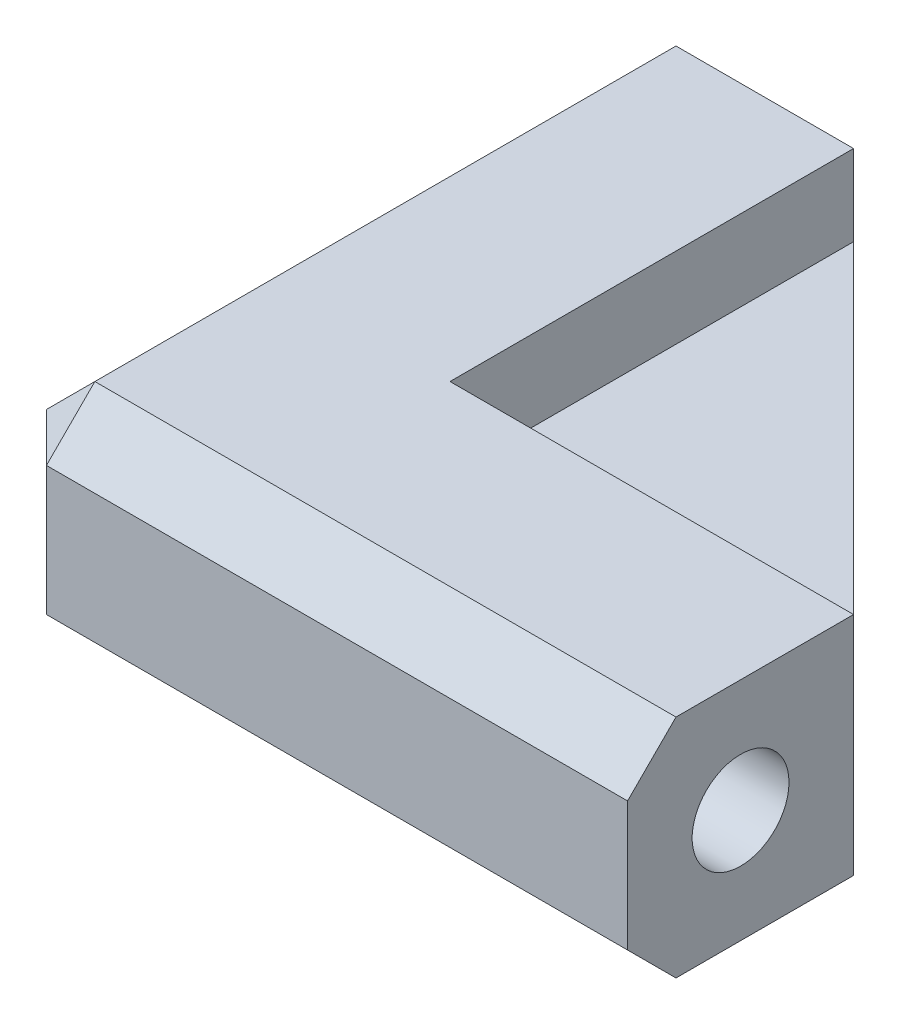
from build123d import *

# Parameters (mm, degrees)
BOSS_EXTRUDE1_DEPTH = 3.5
SKETCH2_R           = 1.5
CUT_EXTRUDE1_DEPTH  = 14
SKETCH3_R           = 1.5
CUT_EXTRUDE2_DEPTH  = 14
BOSS_EXTRUDE2_DEPTH = 1
CHAMFER1_SIZE       = 1.5


with BuildPart() as part:
    # Sketch1 → Boss-Extrude1 (new, symmetric)
    with BuildSketch(Plane(origin=(0, 0, 0), x_dir=(1, 0, 0), z_dir=(0, 1, 0))):
        Polygon((-3.5, 16), (-3.5, -3.5), (16, -3.5), (16, 3.5), (3.5, 3.5), (3.5, 16), align=None)
    extrude(amount=BOSS_EXTRUDE1_DEPTH, both=True)

    # Sketch2 → Cut-Extrude1 (cut)
    with BuildSketch(Plane(origin=(0, 0, -16), x_dir=(-1, 0, 0), z_dir=(0, 0, -1))):
        Circle(SKETCH2_R)
    extrude(amount=-CUT_EXTRUDE1_DEPTH, mode=Mode.SUBTRACT)

    # Sketch3 → Cut-Extrude2 (cut)
    with BuildSketch(Plane(origin=(16, 0, 0), x_dir=(0, 0, -1), z_dir=(1, 0, 0))):
        Circle(SKETCH3_R)
    extrude(amount=-CUT_EXTRUDE2_DEPTH, mode=Mode.SUBTRACT)

    # Sketch4 → Boss-Extrude2 (add, symmetric)
    with BuildSketch(Plane(origin=(0, 0, 0), x_dir=(1, 0, 0), z_dir=(0, 1, 0))):
        Polygon((3.5, 16), (16, 3.5), (3.5, 3.5), align=None)
    extrude(amount=BOSS_EXTRUDE2_DEPTH, both=True)

    # Chamfer1
    chamfer1_edges = [part.edges().sort_by_distance(p)[0] for p in [
        (6.25, -3.5, 3.5),
        (-3.5, -3.5, -6.25),
        (6.25, 3.5, 3.5),
        (-3.5, 3.5, -6.25),
        (-3.5, 0, 3.5),
    ]]
    chamfer(chamfer1_edges, length=CHAMFER1_SIZE)


solid = part.part
